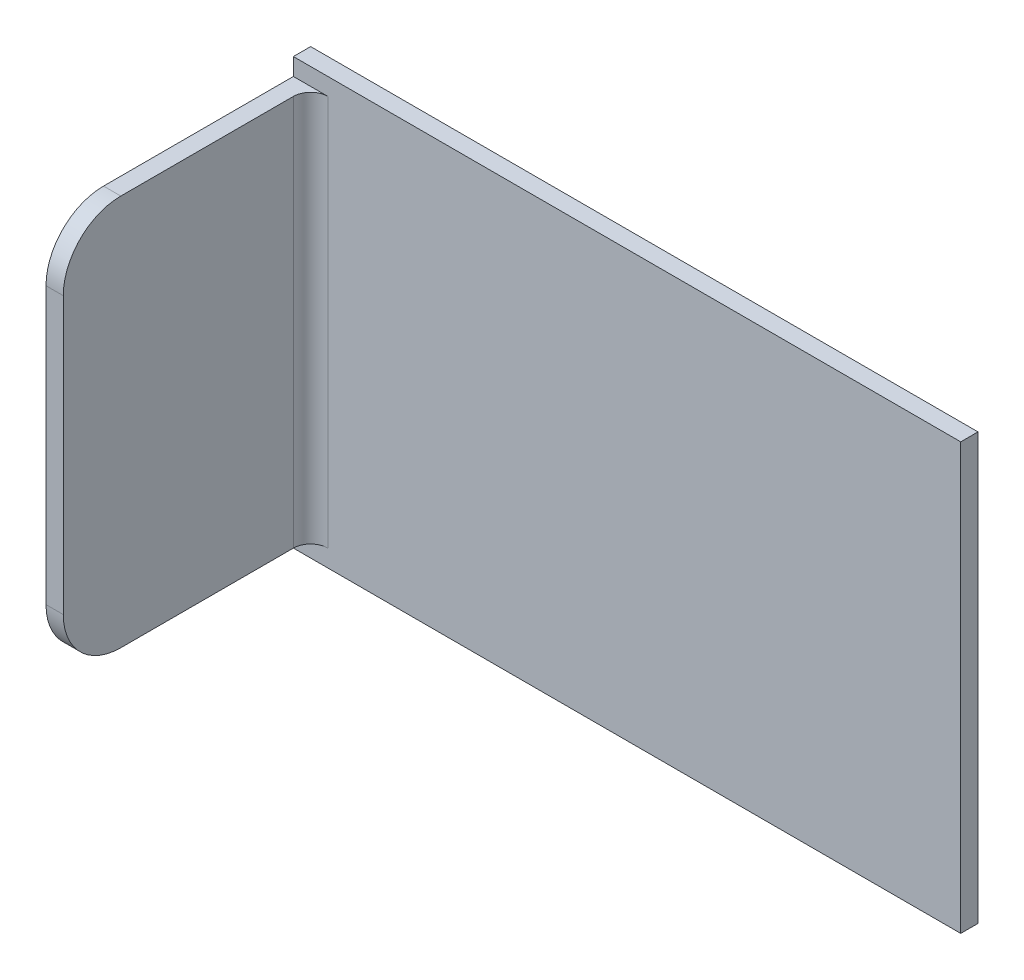
from build123d import *

# Parameters (mm, degrees)
ESBO_O1_W                = 116
ESBO_O1_H                = 74
RESSALTO_EXTRUS_O1_DEPTH = 3
RESSALTO_EXTRUS_O2_DEPTH = 3
FILETE1_R                = 3


with BuildPart() as part:
    # Esboço1 → Ressalto-extrusão1 (new body)
    with BuildSketch(Plane.XY):
        Rectangle(ESBO_O1_W, ESBO_O1_H)
    extrude(amount=RESSALTO_EXTRUS_O1_DEPTH)

    # Esboço2 → Ressalto-extrusão2 (add)
    with BuildSketch(Plane.ZY.offset(58)):
        with BuildLine():
            Line((3, 34), (36, 34))
            ThreePointArc((36, 34), (43.071067812, 31.071067812), (46, 24))
            Line((46, 24), (46, -24))
            ThreePointArc((46, -24), (43.071067812, -31.071067812), (36, -34))
            Line((36, -34), (3, -34))
            Line((3, -34), (3, 34))
        make_face()
    extrude(amount=-RESSALTO_EXTRUS_O2_DEPTH)

    # Filete1
    filete1_edges = [part.edges().sort_by_distance(p)[0] for p in [
        (-55, 0, 3),
    ]]
    fillet(filete1_edges, radius=FILETE1_R)


solid = part.part
